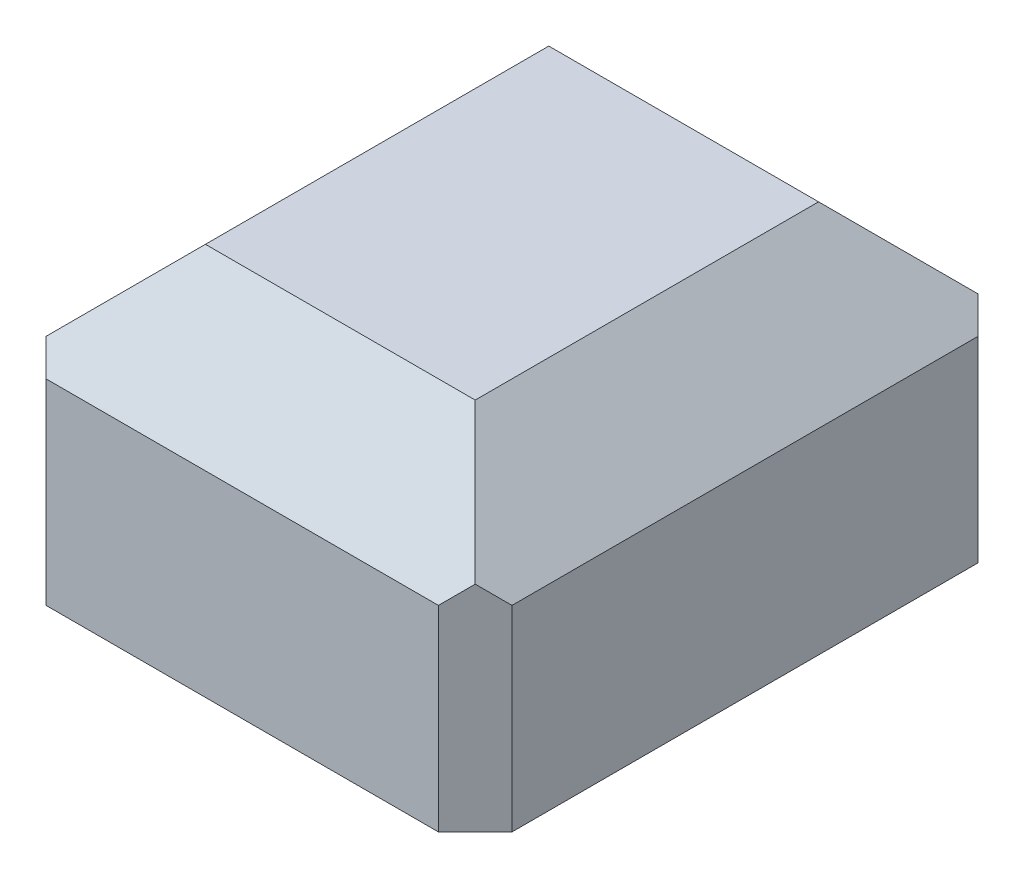
from build123d import *

# Parameters (mm, degrees)
SKETCH1_W           = 190
SKETCH1_H           = 220
BOSS_EXTRUDE1_DEPTH = 120
CHAMFER1_SIZE       = 40
CHAMFER2_SIZE       = 15
SHELL1_T            = -3


with BuildPart() as part:
    # Sketch1 → Boss-Extrude1 (new body)
    with BuildSketch(Plane(origin=(0, 0, 0), x_dir=(1, 0, 0), z_dir=(0, 1, 0))):
        Rectangle(SKETCH1_W, SKETCH1_H)
    extrude(amount=BOSS_EXTRUDE1_DEPTH)

    # Chamfer1
    chamfer1_edges = [part.edges().sort_by_distance(p)[0] for p in [
        (-95, 120, 0),
        (0, 120, 110),
        (95, 120, 0),
        (0, 120, -110),
    ]]
    chamfer(chamfer1_edges, length=CHAMFER1_SIZE)

    # Chamfer2
    chamfer2_edges = [part.edges().sort_by_distance(p)[0] for p in [
        (95, 40, 110),
        (-95, 40, 110),
        (-95, 40, -110),
        (95, 40, -110),
    ]]
    chamfer(chamfer2_edges, length=CHAMFER2_SIZE)

    # Shell1
    shell1_openings = [part.faces().sort_by_distance(p)[0] for p in [
        (0, 0, 0),
    ]]
    offset(amount=SHELL1_T, openings=shell1_openings, kind=Kind.INTERSECTION)


solid = part.part
